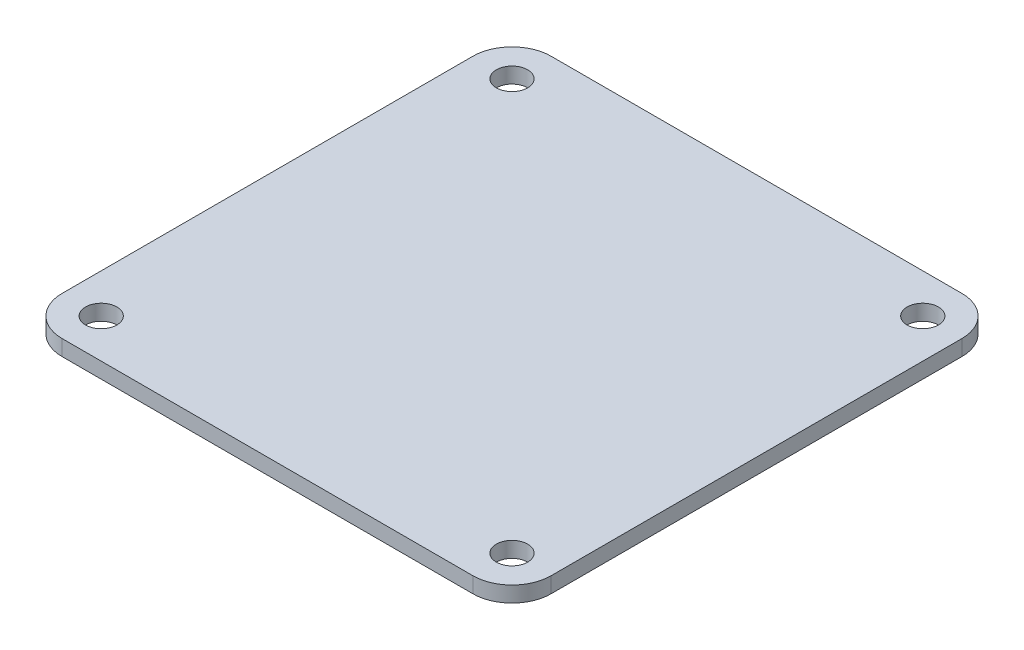
from build123d import *

# Parameters (mm, degrees)
ESBO_O1_W                = 50
ESBO_O1_H                = 50
ESBO_O1_R                = 1.6
RESSALTO_EXTRUS_O1_DEPTH = 1.6
FILETE1_R                = 4


with BuildPart() as part:
    # Esboço1 → Ressalto-extrusão1 (new body)
    with BuildSketch(Plane(origin=(0, 0, 0), x_dir=(1, 0, 0), z_dir=(0, 1, 0))):
        Rectangle(ESBO_O1_W, ESBO_O1_H)
        with Locations(Location((21, -21, 0), (0, 0, 270))):
            Circle(ESBO_O1_R, mode=Mode.SUBTRACT)
        with Locations(Location((21, 21, 0), (0, 0, 270))):
            Circle(ESBO_O1_R, mode=Mode.SUBTRACT)
        with Locations(Location((-21, 21, 0), (0, 0, 270))):
            Circle(ESBO_O1_R, mode=Mode.SUBTRACT)
        with Locations(Location((-21, -21, 0), (0, 0, 270))):
            Circle(ESBO_O1_R, mode=Mode.SUBTRACT)
    extrude(amount=RESSALTO_EXTRUS_O1_DEPTH)

    # Filete1
    filete1_edges = [part.edges().sort_by_distance(p)[0] for p in [
        (25, 0.8, 25),
        (-25, 0.8, 25),
        (-25, 0.8, -25),
        (25, 0.8, -25),
    ]]
    fillet(filete1_edges, radius=FILETE1_R)


solid = part.part
